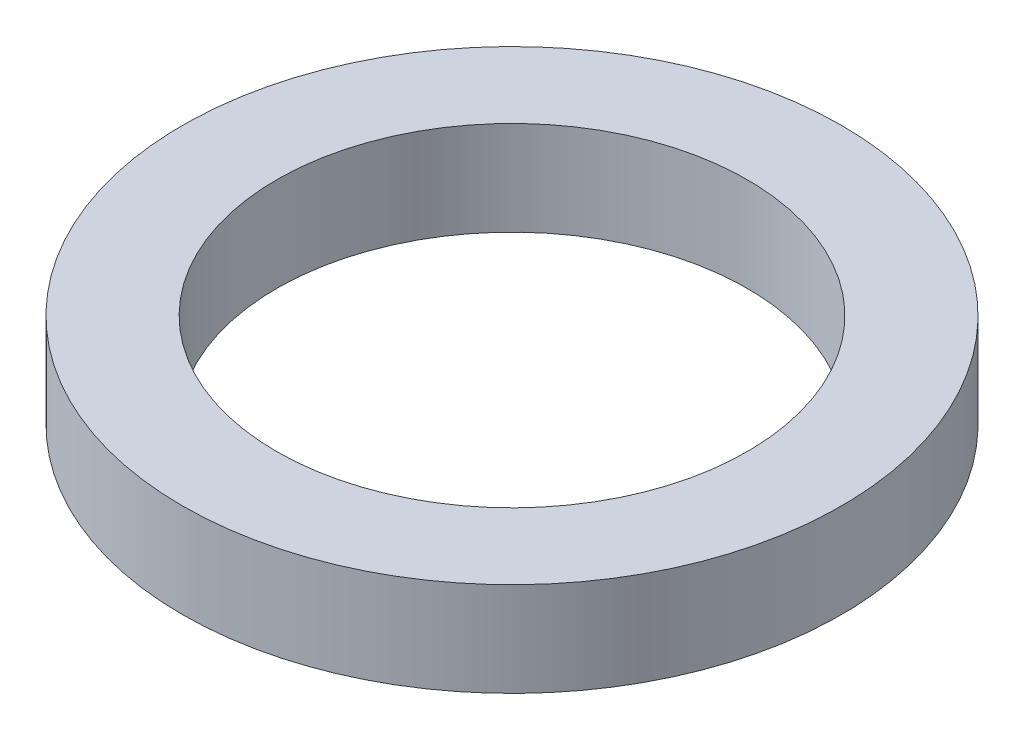
from build123d import *

# Parameters (mm, degrees)
SKETCH1_R           = 3.5
SKETCH1_R_2         = 2.5
BOSS_EXTRUDE1_DEPTH = 1


with BuildPart() as part:
    # Sketch1 → Boss-Extrude1 (new body)
    with BuildSketch(Plane(origin=(0, 0, 0), x_dir=(1, 0, 0), z_dir=(0, 1, 0))):
        with Locations(Location((0, 0, 0), (0, 0, 270))):
            Circle(SKETCH1_R)
        with Locations(Location((0, 0, 0), (0, 0, 270))):
            Circle(SKETCH1_R_2, mode=Mode.SUBTRACT)
    extrude(amount=BOSS_EXTRUDE1_DEPTH)


solid = part.part
